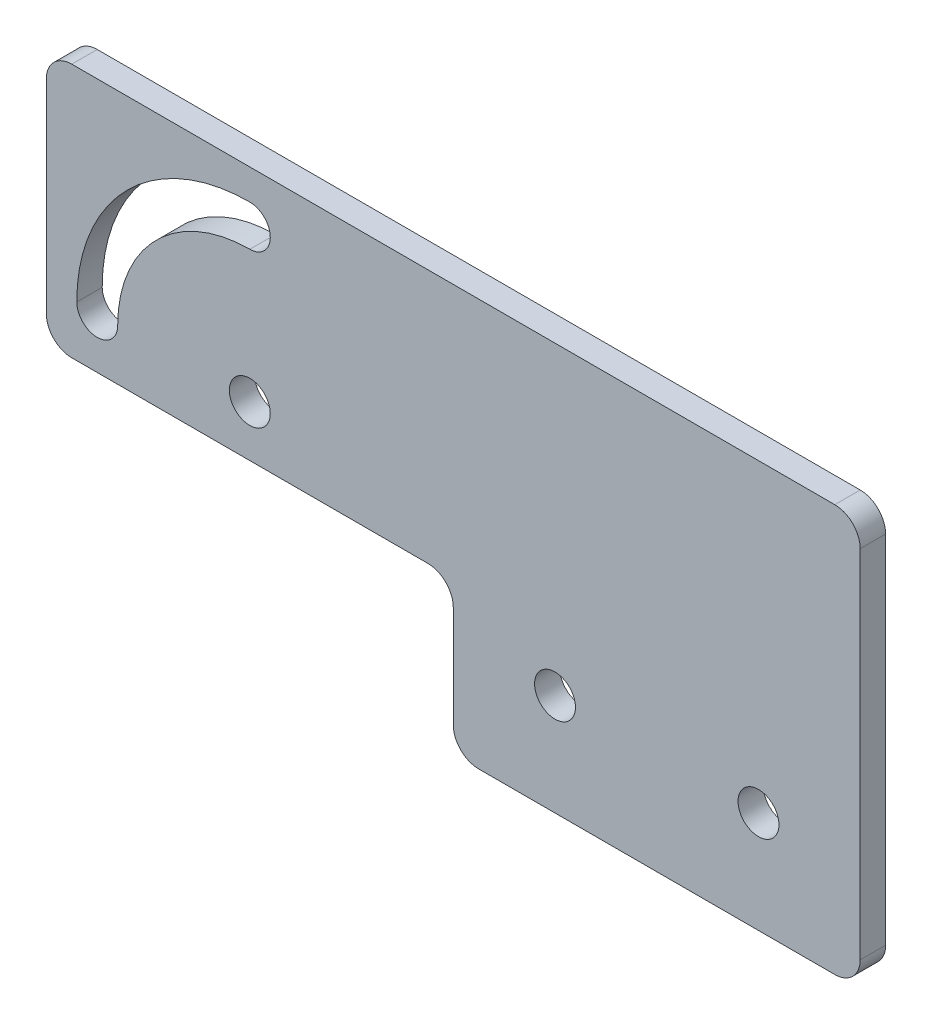
from build123d import *

# Parameters (mm, degrees)
SKETCH1_W           = 50.8
SKETCH1_H           = 50.8
SKETCH1_R           = 2.5527
SKETCH1_H_2         = 31.75
BOSS_EXTRUDE1_DEPTH = 3.175
FILLET1_R           = 3.175


with BuildPart() as part:
    # Sketch1 → Boss-Extrude1 (new body)
    # profile 1 of 2: a face of its own
    with BuildSketch(Plane.XY):
        with Locations((25.4, 25.4)):
            Rectangle(SKETCH1_W, SKETCH1_H)
        with Locations((38.1, 12.7)):
            Circle(SKETCH1_R, mode=Mode.SUBTRACT)
        with Locations((12.7, 12.7)):
            Circle(SKETCH1_R, mode=Mode.SUBTRACT)
    # profile 2 of 2: a face of its own
    with BuildSketch(Plane.XY):
        with Locations((-25.4, 34.925)):
            Rectangle(SKETCH1_W, SKETCH1_H_2)
        with Locations((-25.4, 25.4)):
            Circle(SKETCH1_R, mode=Mode.SUBTRACT)
        with BuildLine():
            ThreePointArc((-41.8973, 25.4), (-44.45, 22.8473), (-47.0027, 25.4))
            ThreePointArc((-47.0027, 25.4), (-40.675415662, 40.675415662), (-25.4, 47.0027))
            ThreePointArc((-25.4, 47.0027), (-22.8473, 44.45), (-25.4, 41.8973))
            ThreePointArc((-25.4, 41.8973), (-37.065352701, 37.065352701), (-41.8973, 25.4))
        make_face(mode=Mode.SUBTRACT)
    extrude(amount=BOSS_EXTRUDE1_DEPTH)

    # Fillet1
    fillet1_edges = [part.edges().sort_by_distance(p)[0] for p in [
        (0, 0, 1.5875),
        (0, 19.05, 1.5875),
        (-50.8, 19.05, 1.5875),
        (-50.8, 50.8, 1.5875),
        (50.8, 50.8, 1.5875),
        (50.8, 0, 1.5875),
    ]]
    fillet(fillet1_edges, radius=FILLET1_R)


solid = part.part
